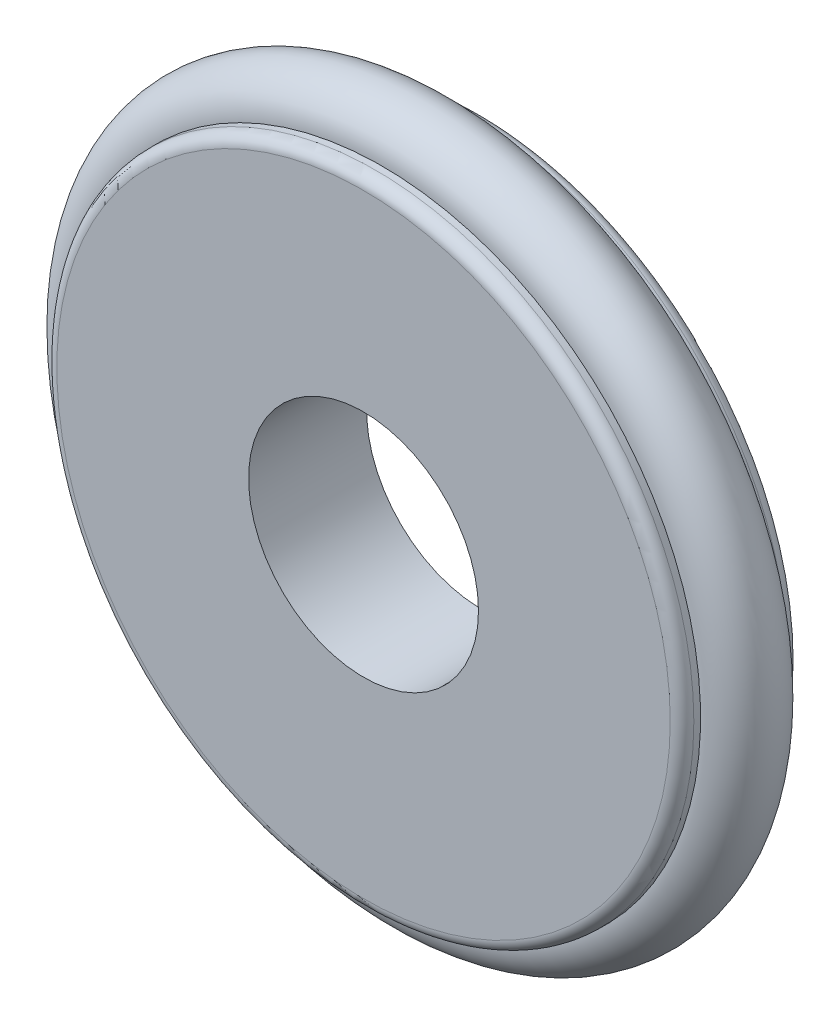
from build123d import *

# Parameters (mm, degrees)
IZIM1_R                     = 27
Y_KSEKLIK_EKSTR_ZYON1_DEPTH = 10
IZIM2_R                     = 9.744373862
KES_EKSTR_ZYON1_DEPTH       = 10
IZIM3_R                     = 3.208877789
RADYUS1_R                   = 1
IZIM4_R                     = 3.195416863


with BuildPart() as part:
    # Çizim1 → Yükseklik-Ekstrüzyon1 (new body)
    with BuildSketch(Plane.XY):
        Circle(IZIM1_R)
    extrude(amount=Y_KSEKLIK_EKSTR_ZYON1_DEPTH)

    # Çizim2 → Kes-Ekstrüzyon1 (cut)
    with BuildSketch(Plane.XY.offset(10)):
        Circle(IZIM2_R)
    extrude(amount=-KES_EKSTR_ZYON1_DEPTH, mode=Mode.SUBTRACT)

    # Çizim3 → Kes-Döndür1 (revolve, cut)
    with BuildSketch(Plane(origin=(0, 0, 0), x_dir=(0, 0, -1), z_dir=(1, 0, 0)), mode=Mode.PRIVATE) as kes_d_nd_r1_sk:
        with Locations((-5.220339572, 26.983745041)):
            Circle(IZIM3_R)
    revolve(kes_d_nd_r1_sk.sketch.rotate(Axis((0, 0, 0), (0, 0, 1)), 90), axis=Axis((0, 0, 0), (0, 0, 1)), mode=Mode.SUBTRACT)

    # Radyus1
    radyus1_edges = [part.edges().sort_by_distance(p)[0] for p in [
        (-27, 0, 0),
        (-27, 0, 10),
    ]]
    fillet(radyus1_edges, radius=RADYUS1_R)


with BuildPart() as body_2:
    # Çizim4 → Döndür1 (revolve)
    with BuildSketch(Plane(origin=(0, 0, 0), x_dir=(0, 0, -1), z_dir=(1, 0, 0)), mode=Mode.PRIVATE) as d_nd_r1_sk:
        with Locations((-5.223146348, 27.103528141)):
            Circle(IZIM4_R)
    revolve(d_nd_r1_sk.sketch.rotate(Axis((0, 0, 0), (0, 0, 1)), 90), axis=Axis((0, 0, 0), (0, 0, 1)))


solid = Compound([part.part, body_2.part])
